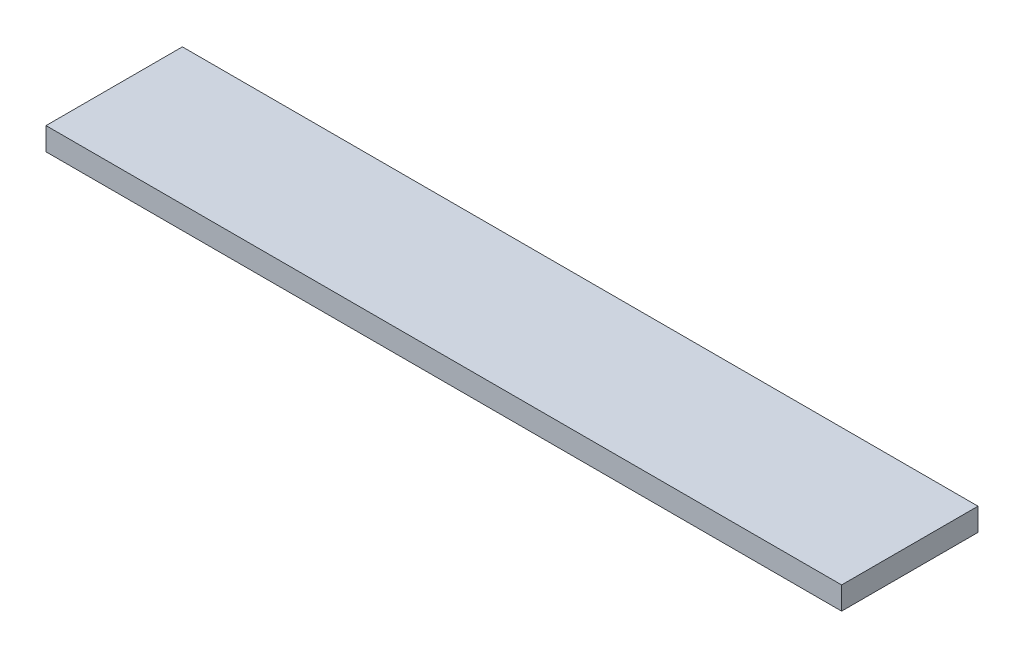
from build123d import *

# Parameters (mm, degrees)
SKETCH1_W             = 35
SKETCH1_H             = 6
BOSS_EXTRUDE1_DEPTH   = 1
BODY_MOVE_COPY1_ANGLE = 90


with BuildPart() as part:
    # Sketch1 → Boss-Extrude1 (new body)
    with BuildSketch(Plane.XY):
        with Locations((-4.811111111, 13.105555556)):
            Rectangle(SKETCH1_W, SKETCH1_H)
    extrude(amount=BOSS_EXTRUDE1_DEPTH)


with BuildPart() as part_1:
    # Body-Move/Copy1: moved
    add(part.part.rotate(Axis((0, 13.105555556, 0.25), (1, 0, 0)), BODY_MOVE_COPY1_ANGLE))


solid = part_1.part
